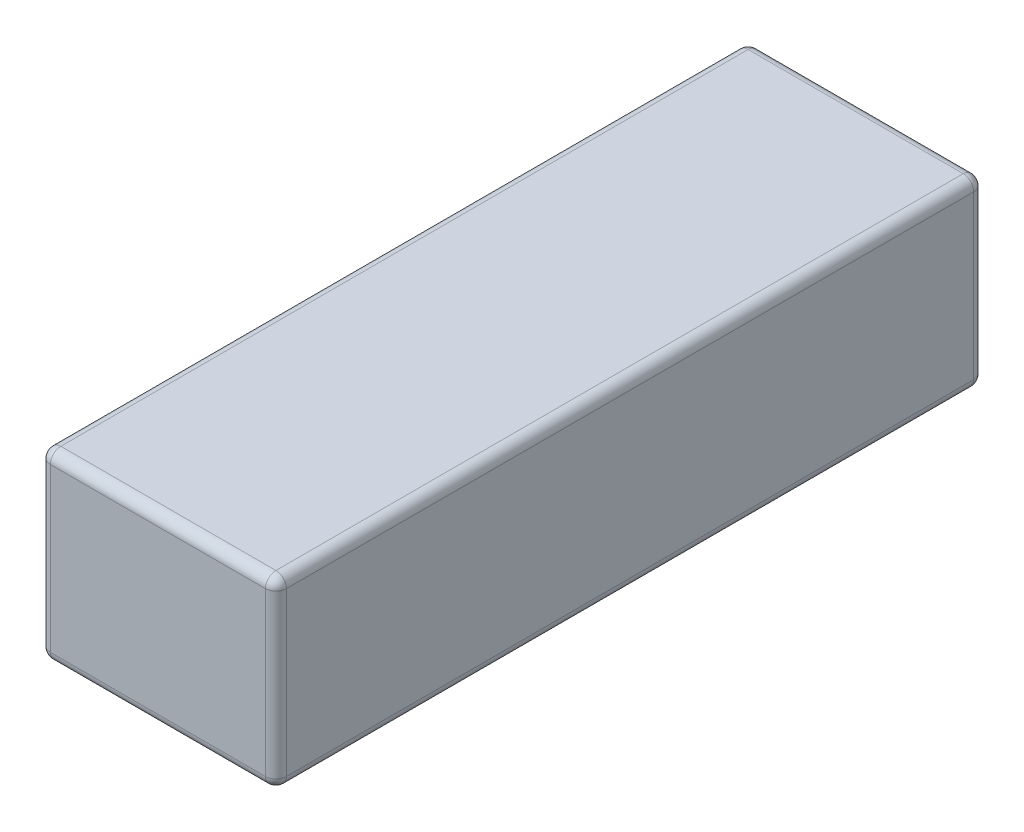
from build123d import *

# Parameters (mm, degrees)
SKETCH1_W           = 45
SKETCH1_H           = 35
BOSS_EXTRUDE1_DEPTH = 67.5
FILLET1_R           = 2


with BuildPart() as part:
    # Sketch1 → Boss-Extrude1 (new, symmetric)
    with BuildSketch(Plane.XY):
        Rectangle(SKETCH1_W, SKETCH1_H)
    extrude(amount=BOSS_EXTRUDE1_DEPTH, both=True)

    # Fillet1
    fillet1_edges = [part.edges().sort_by_distance(p)[0] for p in [
        (-22.5, 0, 67.5),
        (0, -17.5, 67.5),
        (22.5, 0, 67.5),
        (0, -17.5, -67.5),
        (-22.5, 0, -67.5),
        (0, 17.5, -67.5),
        (22.5, 0, -67.5),
        (22.5, -17.5, 0),
        (-22.5, -17.5, 0),
        (-22.5, 17.5, 0),
        (22.5, 17.5, 0),
        (0, 17.5, 67.5),
    ]]
    fillet(fillet1_edges, radius=FILLET1_R)


solid = part.part
